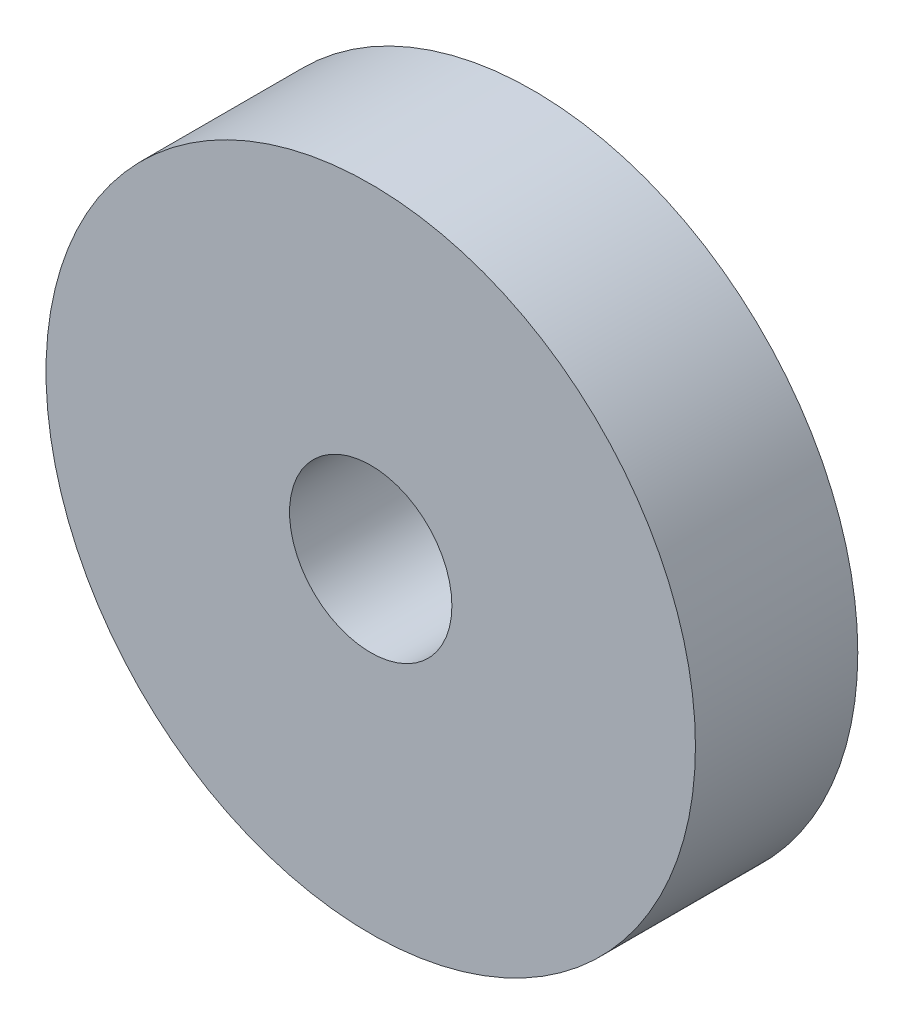
from build123d import *

# Parameters (mm, degrees)
SKETCH1_R           = 20
SKETCH1_R_2         = 5
BOSS_EXTRUDE1_DEPTH = 10


with BuildPart() as part:
    # Sketch1 → Boss-Extrude1 (new body)
    with BuildSketch(Plane.XY):
        Circle(SKETCH1_R)
        Circle(SKETCH1_R_2, mode=Mode.SUBTRACT)
    extrude(amount=BOSS_EXTRUDE1_DEPTH)


solid = part.part
